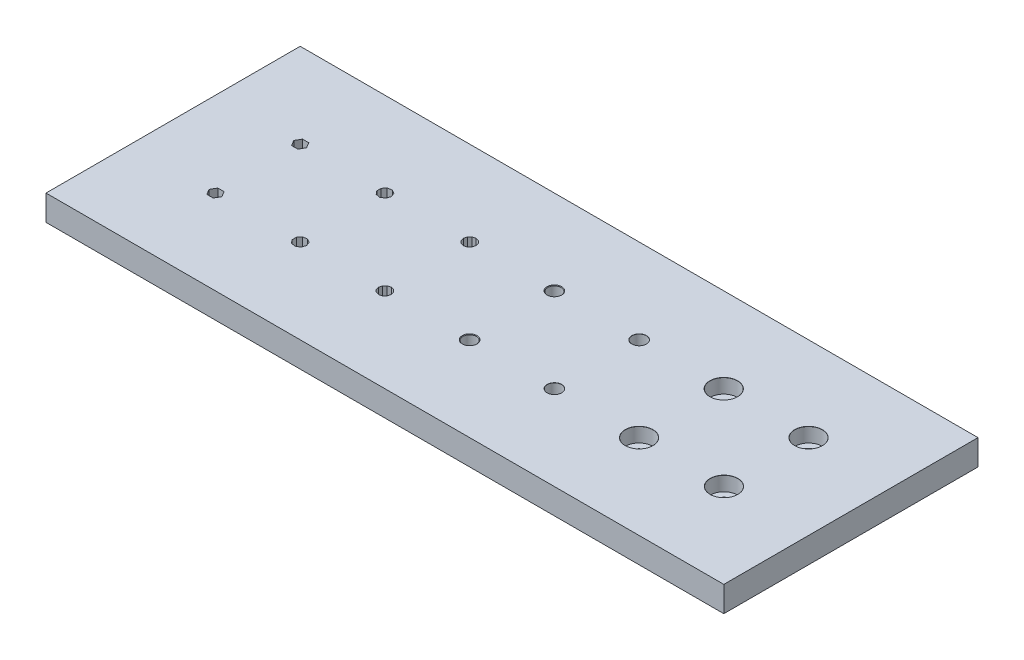
from build123d import *

# Parameters (mm, degrees)
SKETCH1_W                      = 160
SKETCH1_H                      = 60
BOSS_EXTRUDE1_DEPTH            = 6
M3_CLEARANCE_HOLE1_D           = 3.4
M3_CLEARANCE_HOLE1_CSINK_D     = 3.45
M3_CLEARANCE_HOLE1_CSINK_ANGLE = 90
M3_CLEARANCE_HOLE3_D           = 3.4
M3_CLEARANCE_HOLE3_CSINK_D     = 3.45
M3_CLEARANCE_HOLE3_CSINK_ANGLE = 90
M3_CLEARANCE_HOLE4_D           = 3.2
M3_CLEARANCE_HOLE4_CSINK_D     = 3.45
M3_CLEARANCE_HOLE4_CSINK_ANGLE = 90
M3_CLEARANCE_HOLE5_D           = 3.2
M3_CLEARANCE_HOLE5_CSINK_D     = 3.45
M3_CLEARANCE_HOLE5_CSINK_ANGLE = 90
CUT_EXTRUDE3_DEPTH             = 171.985379492
CUT_EXTRUDE4_DEPTH             = 171.985379492
CUT_EXTRUDE5_DEPTH             = 171.985379492
CUT_EXTRUDE6_DEPTH             = 171.985379492
CUT_EXTRUDE7_DEPTH             = 171.985379492
CUT_EXTRUDE8_DEPTH             = 171.985379492


with BuildPart() as part:
    # Sketch1 → Boss-Extrude1 (new body)
    with BuildSketch(Plane(origin=(0, 0, 0), x_dir=(1, 0, 0), z_dir=(0, 1, 0))):
        with Locations((80, 30)):
            Rectangle(SKETCH1_W, SKETCH1_H)
    extrude(amount=BOSS_EXTRUDE1_DEPTH)

    # Sketch4 → CBORE for M3 Hex Socket Head Cap Screw1 (revolve, cut)
    with BuildSketch(Plane(origin=(139.992504276, 6, -20.042969634), x_dir=(0, 0, 1), z_dir=(1, 0, 0))):
        Polygon((0, 0), (0, 6), (1.7, 6), (1.7, 3.4), (3.25, 3.4), (3.25, 0.025), (3.275, 0), align=None)
    revolve(axis=Axis((139.992504276, 12.35, -20.042969634), (0, -1, 0)), mode=Mode.SUBTRACT)

    # Sketch7 → CBORE for M3 Hex Socket Head Cap Screw2 (revolve, cut)
    with BuildSketch(Plane(origin=(140.004074622, 6, -39.992947499), x_dir=(0, 0, 1), z_dir=(1, 0, 0))):
        Polygon((0, 0), (0, 6), (1.7, 6), (1.7, 3.4), (3.25, 3.4), (3.25, 0.025), (3.275, 0), align=None)
    revolve(axis=Axis((140.004074622, 12.35, -39.992947499), (0, -1, 0)), mode=Mode.SUBTRACT)

    # Sketch10 → CBORE for M3 Hex Socket Head Cap Screw3 (revolve, cut)
    with BuildSketch(Plane(origin=(120.000202739, 6, -39.984949452), x_dir=(0, 0, 1), z_dir=(1, 0, 0))):
        Polygon((0, 0), (0, 6), (1.6, 6), (1.6, 3.4), (3.25, 3.4), (3.25, 0.025), (3.275, 0), align=None)
    revolve(axis=Axis((120.000202739, 12.35, -39.984949452), (0, -1, 0)), mode=Mode.SUBTRACT)

    # Sketch13 → CBORE for M3 Hex Socket Head Cap Screw4 (revolve, cut)
    with BuildSketch(Plane(origin=(119.997329442, 6, -19.99932447), x_dir=(0, 0, 1), z_dir=(1, 0, 0))):
        Polygon((0, 0), (0, 6), (1.6, 6), (1.6, 3.4), (3.25, 3.4), (3.25, 0.025), (3.275, 0), align=None)
    revolve(axis=Axis((119.997329442, 12.35, -19.99932447), (0, -1, 0)), mode=Mode.SUBTRACT)

    # M3 Clearance Hole1 (through all)
    with Locations(Plane(origin=(0, 6, 0), x_dir=(1, 0, 0), z_dir=(0, 1, 0))):
        with Locations((100.019720451, 40.002637401)):
            CounterSinkHole(M3_CLEARANCE_HOLE1_D / 2, M3_CLEARANCE_HOLE1_CSINK_D / 2, counter_sink_angle=M3_CLEARANCE_HOLE1_CSINK_ANGLE)

    # M3 Clearance Hole3 (through all)
    with Locations(Plane(origin=(0, 6, 0), x_dir=(1, 0, 0), z_dir=(0, 1, 0))):
        with Locations((99.99392625, 20.015973)):
            CounterSinkHole(M3_CLEARANCE_HOLE3_D / 2, M3_CLEARANCE_HOLE3_CSINK_D / 2, counter_sink_angle=M3_CLEARANCE_HOLE3_CSINK_ANGLE)

    # M3 Clearance Hole4 (through all)
    with Locations(Plane(origin=(0, 6, 0), x_dir=(1, 0, 0), z_dir=(0, 1, 0))):
        with Locations((79.997225907, 40.005191988)):
            CounterSinkHole(M3_CLEARANCE_HOLE4_D / 2, M3_CLEARANCE_HOLE4_CSINK_D / 2, counter_sink_angle=M3_CLEARANCE_HOLE4_CSINK_ANGLE)

    # M3 Clearance Hole5 (through all)
    with Locations(Plane(origin=(0, 6, 0), x_dir=(1, 0, 0), z_dir=(0, 1, 0))):
        with Locations((79.991526723, 20.004071528)):
            CounterSinkHole(M3_CLEARANCE_HOLE5_D / 2, M3_CLEARANCE_HOLE5_CSINK_D / 2, counter_sink_angle=M3_CLEARANCE_HOLE5_CSINK_ANGLE)

    # Sketch2 → Cut-Extrude3 (cut, through all)
    with BuildSketch(Plane(origin=(0, 6, 0), x_dir=(1, 0, 0), z_dir=(0, 1, 0))):
        Polygon((61.499825244, 20.000000122), (61.29888673, 20.749912866), (60.7499125, 21.298887096), (59.999999756, 21.49982561), (59.250087012, 21.298887096), (58.701112782, 20.749912866), (58.500174268, 20.000000122), (58.701112782, 19.250087378), (59.250087012, 18.701113148), (59.999999756, 18.500174634), (60.7499125, 18.701113148), (61.29888673, 19.250087378), align=None)
    extrude(amount=-CUT_EXTRUDE3_DEPTH, mode=Mode.SUBTRACT)

    # Sketch35 → Cut-Extrude4 (cut, through all)
    with BuildSketch(Plane(origin=(0, 6, 0), x_dir=(1, 0, 0), z_dir=(0, 1, 0))):
        Polygon((58.500006975, 40), (58.700967935, 39.250003488), (59.250003488, 38.700967935), (60, 38.500006975), (60.749996512, 38.700967935), (61.299032065, 39.250003488), (61.499993025, 40), (61.299032065, 40.749996512), (60.749996512, 41.299032065), (60, 41.499993025), (59.250003488, 41.299032065), (58.700967935, 40.749996512), align=None)
    extrude(amount=-CUT_EXTRUDE4_DEPTH, mode=Mode.SUBTRACT)

    # Sketch36 → Cut-Extrude5 (cut, through all)
    with BuildSketch(Plane(origin=(0, 6, 0), x_dir=(1, 0, 0), z_dir=(0, 1, 0))):
        Polygon((41.5, 20), (41.149066665, 20.964181415), (40.260472267, 21.47721163), (39.25, 21.299038106), (38.590461069, 20.513030215), (38.590461069, 19.486969785), (39.25, 18.700961894), (40.260472267, 18.52278837), (41.149066665, 19.035818585), align=None)
    extrude(amount=-CUT_EXTRUDE5_DEPTH, mode=Mode.SUBTRACT)

    # Sketch37 → Cut-Extrude6 (cut, through all)
    with BuildSketch(Plane(origin=(0, 6, 0), x_dir=(1, 0, 0), z_dir=(0, 1, 0))):
        Polygon((41.5, 40), (41.149066665, 40.964181415), (40.260472267, 41.47721163), (39.25, 41.299038106), (38.590461069, 40.513030215), (38.590461069, 39.486969785), (39.25, 38.700961894), (40.260472267, 38.52278837), (41.149066665, 39.035818585), align=None)
    extrude(amount=-CUT_EXTRUDE6_DEPTH, mode=Mode.SUBTRACT)

    # Sketch38 → Cut-Extrude7 (cut, through all)
    with BuildSketch(Plane(origin=(0, 6, 0), x_dir=(1, 0, 0), z_dir=(0, 1, 0))):
        Polygon((21.5, 20), (20.75, 21.299038106), (19.25, 21.299038106), (18.5, 20), (19.25, 18.700961894), (20.75, 18.700961894), align=None)
    extrude(amount=-CUT_EXTRUDE7_DEPTH, mode=Mode.SUBTRACT)

    # Sketch39 → Cut-Extrude8 (cut, through all)
    with BuildSketch(Plane(origin=(0, 6, 0), x_dir=(1, 0, 0), z_dir=(0, 1, 0))):
        Polygon((21.5, 40), (20.75, 41.299038106), (19.25, 41.299038106), (18.5, 40), (19.25, 38.700961894), (20.75, 38.700961894), align=None)
    extrude(amount=-CUT_EXTRUDE8_DEPTH, mode=Mode.SUBTRACT)


solid = part.part
